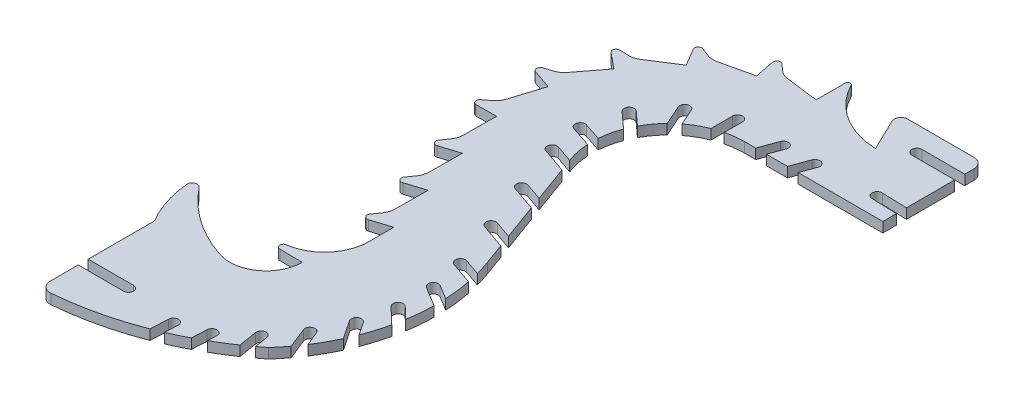
from build123d import *

# Parameters (mm, degrees)
BOSS_EXTRUDE1_DEPTH = 1.5


with BuildPart() as part:
    # Sketch2 → Boss-Extrude1 (new, symmetric)
    with BuildSketch(Plane(origin=(0, 0, 0), x_dir=(1, 0, 0), z_dir=(0, 1, 0))):
        with BuildLine():
            Line((30.591679445, -19.706623157), (10.770896214, -19.706623157))
            ThreePointArc((10.770896214, -19.706623157), (9.076937462, -20.64337166), (8.969792035, -22.576119411))
            Line((8.969792035, -22.576119411), (13.591679445, -32.150054537))
            ThreePointArc((13.591679445, -32.150054537), (1.806311677, -28.503217801), (-6.481850683, -19.365347355))
            ThreePointArc((-6.481850683, -19.365347355), (-7.329714805, -18.973260105), (-7.908320555, -19.706623157))
            Line((-7.908320555, -19.706623157), (-7.908320555, -28.434794524))
            Line((-7.908320555, -28.434794524), (-17.717270868, -27.190536985))
            ThreePointArc((-17.717270868, -27.190536985), (-19.17127418, -26.775639198), (-20.434766861, -25.945065874))
            Line((-20.434766861, -25.945065874), (-22.368397889, -24.203029717))
            ThreePointArc((-22.368397889, -24.203029717), (-23.644804751, -24.062024553), (-24.185069934, -25.227018315))
            Line((-24.185069934, -25.227018315), (-23.051682778, -31.150054537))
            Line((-23.051682778, -31.150054537), (-32.696342525, -33.32817791))
            ThreePointArc((-32.696342525, -33.32817791), (-34.204645366, -33.434424528), (-35.675741006, -33.084934296))
            Line((-35.675741006, -33.084934296), (-38.087810206, -32.10741647))
            ThreePointArc((-38.087810206, -32.10741647), (-39.335703498, -32.410499403), (-39.445932488, -33.689931505))
            Line((-39.445932488, -33.689931505), (-36.359135638, -38.870530866))
            Line((-36.359135638, -38.870530866), (-44.681352429, -44.209481207))
            ThreePointArc((-44.681352429, -44.209481207), (-46.062834409, -44.824113897), (-47.56488054, -44.997674328))
            Line((-47.56488054, -44.997674328), (-50.165741228, -44.902057369))
            ThreePointArc((-50.165741228, -44.902057369), (-51.235271124, -45.61283352), (-50.902227376, -46.853066883))
            Line((-50.902227376, -46.853066883), (-46.232690326, -50.669131384))
            Line((-46.232690326, -50.669131384), (-52.23311369, -58.527795553))
            ThreePointArc((-52.23311369, -58.527795553), (-53.321883351, -59.577007842), (-54.674510903, -60.252777411))
            Line((-54.674510903, -60.252777411), (-57.151845891, -61.050543216))
            ThreePointArc((-57.151845891, -61.050543216), (-57.914580839, -62.083660989), (-57.178256994, -63.135765608))
            Line((-57.178256994, -63.135765608), (-51.486708234, -65.129053658))
            Line((-51.486708234, -65.129053658), (-54.444793865, -74.563745623))
            ThreePointArc((-54.444793865, -74.563745623), (-55.110109303, -75.921545745), (-56.150891723, -77.018376524))
            Line((-56.150891723, -77.018376524), (-58.207217064, -78.613727586))
            ThreePointArc((-58.207217064, -78.613727586), (-58.571566141, -79.84512788), (-57.520381618, -80.58276467))
            Line((-57.520381618, -80.58276467), (-51.490275099, -80.513917766))
            Line((-51.490275099, -80.513917766), (-51.582107694, -90.401043225))
            ThreePointArc((-51.582107694, -90.401043225), (-51.824606324, -91.893511053), (-52.50216174, -93.245244926))
            Line((-52.50216174, -93.245244926), (-54.006808008, -95.368840587))
            ThreePointArc((-54.006808008, -95.368840587), (-53.997994509, -96.652982034), (-52.777943617, -97.05369734))
            Line((-52.777943617, -97.05369734), (-47.027500975, -95.23729046))
            Line((-47.027500975, -95.23729046), (-47.119333571, -105.124415919))
            ThreePointArc((-47.119333571, -105.124415919), (-47.361832201, -106.616883747), (-48.039387616, -107.96861762))
            Line((-48.039387616, -107.96861762), (-49.544033884, -110.092213281))
            ThreePointArc((-49.544033884, -110.092213281), (-49.535220385, -111.376354728), (-48.315169494, -111.777070034))
            Line((-48.315169494, -111.777070034), (-42.564726852, -109.960663154))
            Line((-42.564726852, -109.960663154), (-42.656559447, -119.847788613))
            ThreePointArc((-42.656559447, -119.847788613), (-42.899058077, -121.340256441), (-43.576613493, -122.691990314))
            Line((-43.576613493, -122.691990314), (-45.081259761, -124.815585975))
            ThreePointArc((-45.081259761, -124.815585975), (-45.072446262, -126.099727422), (-43.85239537, -126.500442728))
            Line((-43.85239537, -126.500442728), (-38.101952728, -124.684035848))
            Line((-38.101952728, -124.684035848), (-38.101952728, -132.095701332))
            ThreePointArc((-38.101952728, -132.095701332), (-41.38920982, -140.864125187), (-49.630647576, -145.310474229))
            ThreePointArc((-49.630647576, -145.310474229), (-50.53847374, -146.425459682), (-49.487786241, -147.406987411))
            Line((-49.487786241, -147.406987411), (-42.695203119, -147.470077593))
            ThreePointArc((-42.695203119, -147.470077593), (-47.251098602, -156.251496048), (-57.02749202, -157.765307622))
            ThreePointArc((-57.02749202, -157.765307622), (-68.364215467, -152.127529046), (-77.60131239, -143.468320872))
            ThreePointArc((-77.60131239, -143.468320872), (-79.308701216, -143.01747095), (-80.227840114, -144.525325698))
            ThreePointArc((-80.227840114, -144.525325698), (-78.693532024, -151.963379598), (-75.571881233, -158.886821189))
            Line((-75.571881233, -158.886821189), (-75.571881233, -178.706821189))
            Line((-75.571881233, -178.706821189), (-62.012240233, -178.706821189))
            ThreePointArc((-62.012240233, -178.706821189), (-60.512240233, -180.206821189), (-62.012240233, -181.706821189))
            Line((-62.012240233, -181.706821189), (-75.571881233, -181.706821189))
            Line((-75.571881233, -181.706821189), (-75.571881233, -190.103648127))
            ThreePointArc((-75.571881233, -190.103648127), (-74.601803937, -192.312587651), (-72.318938688, -193.092965787))
            ThreePointArc((-72.318938688, -193.092965787), (-60.088428799, -191.172622819), (-48.255167855, -187.532976584))
            Line((-48.255167855, -187.532976584), (-47.991619574, -182.190472639))
            ThreePointArc((-47.991619574, -182.190472639), (-46.419535523, -180.766200285), (-44.99526317, -182.338284336))
            Line((-44.99526317, -182.338284336), (-45.189570528, -186.277174862))
            ThreePointArc((-45.189570528, -186.277174862), (-42.426706717, -185.025671711), (-39.709222418, -183.678468808))
            Line((-39.709222418, -183.678468808), (-39.486721817, -179.168060553))
            ThreePointArc((-39.486721817, -179.168060553), (-37.914637766, -177.743788199), (-36.490365413, -179.31587225))
            Line((-36.490365413, -179.31587225), (-36.622806434, -182.00064286))
            ThreePointArc((-36.622806434, -182.00064286), (-33.568117965, -180.175222106), (-30.590762677, -178.226212601))
            Line((-30.590762677, -178.226212601), (-31.505833228, -172.73534794))
            ThreePointArc((-31.505833228, -172.73534794), (-30.272818323, -171.009174645), (-28.546645028, -172.24218955))
            Line((-28.546645028, -172.24218955), (-27.872343878, -176.288321681))
            ThreePointArc((-27.872343878, -176.288321681), (-26.787296496, -175.469683596), (-25.715192007, -174.63416693))
            ThreePointArc((-25.715192007, -174.63416693), (-24.131271892, -172.792491831), (-22.631138333, -170.881950179))
            Line((-22.631138333, -170.881950179), (-25.076513826, -164.751725562))
            ThreePointArc((-25.076513826, -164.751725562), (-24.239043456, -162.80271469), (-22.290032584, -163.640185061))
            Line((-22.290032584, -163.640185061), (-20.574340605, -167.941192099))
            ThreePointArc((-20.574340605, -167.941192099), (-18.553427823, -164.579630172), (-16.779957492, -161.081203377))
            Line((-16.779957492, -161.081203377), (-20.493243678, -155.582864729))
            ThreePointArc((-20.493243678, -155.582864729), (-20.08967623, -153.500286203), (-18.007097704, -153.903853651))
            Line((-18.007097704, -153.903853651), (-15.385652544, -157.785481008))
            ThreePointArc((-15.385652544, -157.785481008), (-14.110645837, -154.078891897), (-13.1058259, -150.290121407))
            Line((-13.1058259, -150.290121407), (-17.965948842, -145.648723848))
            ThreePointArc((-17.965948842, -145.648723848), (-18.014768788, -143.527965348), (-15.894010288, -143.479145402))
            Line((-15.894010288, -143.479145402), (-12.430549265, -146.786736534))
            ThreePointArc((-12.430549265, -146.786736534), (-11.95484064, -142.892533529), (-11.760997702, -138.974174094))
            Line((-11.760997702, -138.974174094), (-17.610386199, -135.404313204))
            ThreePointArc((-17.610386199, -135.404313204), (-18.109357454, -133.342511155), (-16.047555405, -132.8435399))
            Line((-16.047555405, -132.8435399), (-11.829755074, -135.417648366))
            ThreePointArc((-11.829755074, -135.417648366), (-12.176031219, -131.500664891), (-12.804327894, -127.618924303))
            Line((-12.804327894, -127.618924303), (-19.44284147, -125.318854269))
            ThreePointArc((-19.44284147, -125.318854269), (-20.369109813, -123.410444734), (-18.460700277, -122.484176391))
            Line((-18.460700277, -122.484176391), (-13.610256797, -124.16472725))
            ThreePointArc((-13.610256797, -124.16472725), (-14.277755396, -121.875672695), (-15.044910568, -119.618063766))
            Line((-15.044910568, -119.618063766), (-17.284941751, -113.47159106))
            Line((-17.284941751, -113.47159106), (-24.696307823, -110.903748001))
            ThreePointArc((-24.696307823, -110.903748001), (-25.622576166, -108.995338465), (-23.71416663, -108.069070122))
            Line((-23.71416663, -108.069070122), (-18.609250916, -109.837788906))
            Line((-18.609250916, -109.837788906), (-22.538408103, -99.056484792))
            Line((-22.538408103, -99.056484792), (-29.949774176, -96.488641733))
            ThreePointArc((-29.949774176, -96.488641733), (-30.876042519, -94.580232197), (-28.967632983, -93.653963854))
            Line((-28.967632983, -93.653963854), (-23.862717269, -95.422682638))
            Line((-23.862717269, -95.422682638), (-27.791874456, -84.641378524))
            Line((-27.791874456, -84.641378524), (-35.203240529, -82.073535465))
            ThreePointArc((-35.203240529, -82.073535465), (-36.129508872, -80.165125929), (-34.221099336, -79.238857586))
            Line((-34.221099336, -79.238857586), (-29.116183622, -81.00757637))
            ThreePointArc((-29.116183622, -81.00757637), (-30.1141914, -77.651243282), (-30.588013113, -74.181879608))
            Line((-30.588013113, -74.181879608), (-36.721638819, -72.148081411))
            ThreePointArc((-36.721638819, -72.148081411), (-37.673313604, -70.252213508), (-35.777445701, -69.300538724))
            Line((-35.777445701, -69.300538724), (-30.556950774, -71.031559441))
            ThreePointArc((-30.556950774, -71.031559441), (-30.085277477, -67.879812555), (-29.179973773, -64.824258704))
            Line((-29.179973773, -64.824258704), (-33.96481563, -60.481104573))
            ThreePointArc((-33.96481563, -60.481104573), (-34.067342644, -58.36226333), (-31.948501401, -58.259736316))
            Line((-31.948501401, -58.259736316), (-27.875992931, -61.956312402))
            ThreePointArc((-27.875992931, -61.956312402), (-26.168557811, -59.265466913), (-24.103577818, -56.83815528))
            Line((-24.103577818, -56.83815528), (-26.720078495, -50.929549385))
            ThreePointArc((-26.720078495, -50.929549385), (-25.955896706, -48.95065419), (-23.977001511, -49.71483598))
            Line((-23.977001511, -49.71483598), (-21.750026934, -54.743810452))
            ThreePointArc((-21.750026934, -54.743810452), (-19.099282912, -52.974759784), (-16.228320555, -51.591445186))
            Line((-16.228320555, -51.591445186), (-16.228320555, -45.129425423))
            ThreePointArc((-16.228320555, -45.129425423), (-14.728320555, -43.629425423), (-13.228320555, -45.129425423))
            Line((-13.228320555, -45.129425423), (-13.228320555, -50.629425423))
            ThreePointArc((-13.228320555, -50.629425423), (-10.515640107, -50.132928523), (-7.762916563, -49.966623157))
            Line((-7.762916563, -49.966623157), (-4.465656067, -49.966623157))
            Line((-4.465656067, -49.966623157), (-2.484608241, -44.590523703))
            ThreePointArc((-2.484608241, -44.590523703), (-0.558480265, -43.701686811), (0.330356627, -45.627814787))
            Line((0.330356627, -45.627814787), (-1.268458083, -49.966623157))
            Line((-1.268458083, -49.966623157), (5.034343933, -49.966623157))
            Line((5.034343933, -49.966623157), (7.015391759, -44.590523703))
            ThreePointArc((7.015391759, -44.590523703), (8.941519735, -43.701686811), (9.830356627, -45.627814787))
            Line((9.830356627, -45.627814787), (8.231541917, -49.966623157))
            Line((8.231541917, -49.966623157), (33.591679445, -49.966623157))
            Line((33.591679445, -49.966623157), (33.591679445, -45.906623157))
            Line((33.591679445, -45.906623157), (26.008416441, -45.641809778))
            ThreePointArc((26.008416441, -45.641809778), (24.561679445, -44.090374292), (26.113114931, -42.643637297))
            Line((26.113114931, -42.643637297), (33.591679445, -42.904794524))
            Line((33.591679445, -42.904794524), (33.591679445, -28.434794524))
            Line((33.591679445, -28.434794524), (20.741679445, -28.434794524))
            ThreePointArc((20.741679445, -28.434794524), (19.241679445, -26.934794524), (20.741679445, -25.434794524))
            Line((20.741679445, -25.434794524), (33.591679445, -25.434794524))
            Line((33.591679445, -25.434794524), (33.591679445, -22.706623157))
            ThreePointArc((33.591679445, -22.706623157), (32.712999789, -20.585302814), (30.591679445, -19.706623157))
        make_face()
    extrude(amount=BOSS_EXTRUDE1_DEPTH, both=True)


solid = part.part
